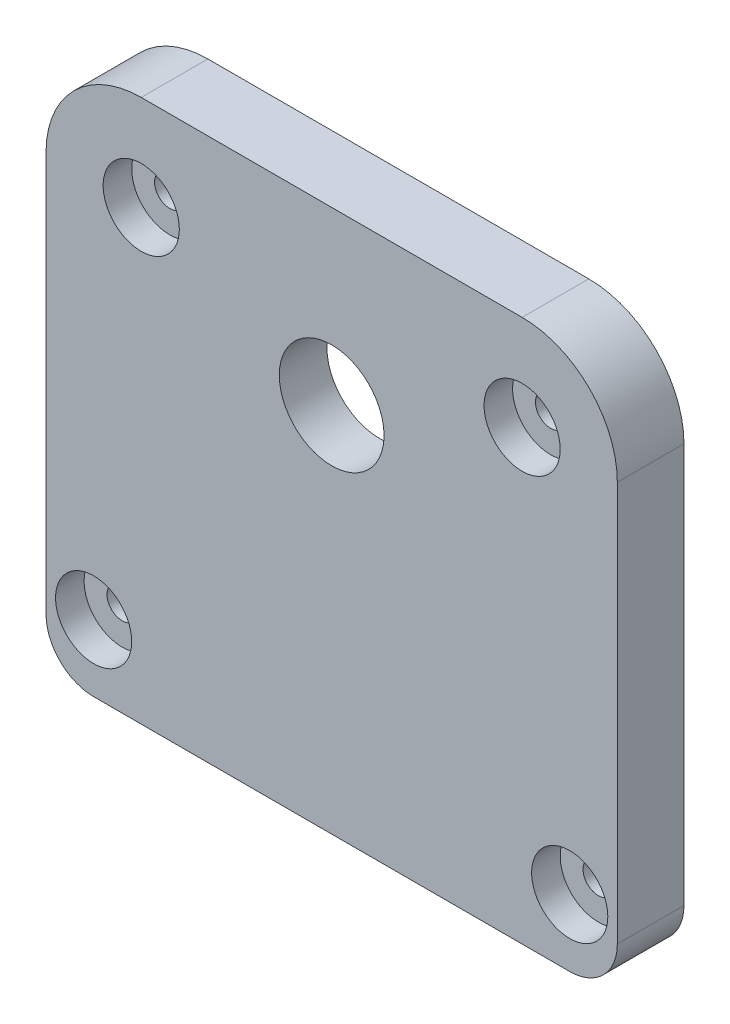
from build123d import *

# Parameters (mm, degrees)
SKETCH_1_W          = 60
SKETCH_1_H          = 50
SKETCH_1_R          = 15
EXTRUDE_5_DEPTH     = 5
SKETCH_4_W          = 60
SKETCH_4_H          = 50
SKETCH_4_R          = 5.5
EXTRUDE_6_DEPTH     = 5
SKETCH_5_R          = 1.6
CUT_EXTRUDE_1_DEPTH = 10
SKETCH_6_W          = 60
SKETCH_6_H          = 10
EXTRUDE_7_DEPTH     = 7
FILLET_3_R          = 10
FILLET_5_R          = 10
FILLET_6_R          = 5
FILLET_7_R          = 5
SKETCH_8_R          = 41.984876442
CUT_EXTRUDE_3_DEPTH = 3
SKETCH_7_R          = 4
CUT_EXTRUDE_4_DEPTH = 3
SKETCH_9_R          = 15
EXTRUDE_8_DEPTH     = 7
SKETCH_10_R         = 15
CUT_EXTRUDE_5_DEPTH = 2
SKETCH_11_R         = 5.5
CUT_EXTRUDE_6_DEPTH = 45.147480109


with BuildPart() as part:
    # 草图1 → 凸台-拉伸5 (new body)
    with BuildSketch(Plane.XY):
        Rectangle(SKETCH_1_W, SKETCH_1_H)
        Circle(SKETCH_1_R, mode=Mode.SUBTRACT)
    extrude(amount=EXTRUDE_5_DEPTH)

    # 草图4 → 凸台-拉伸6 (add)
    with BuildSketch(Plane.XY.offset(5)):
        Rectangle(SKETCH_4_W, SKETCH_4_H)
        Circle(SKETCH_4_R, mode=Mode.SUBTRACT)
    extrude(amount=EXTRUDE_6_DEPTH)

    # 草图5 → 切除-拉伸1 (cut)
    with BuildSketch(Plane(origin=(0, 0, 0), x_dir=(-1, 0, 0), z_dir=(0, 0, -1))):
        with Locations((-20, 22)):
            Circle(SKETCH_5_R)
        with Locations((-25, -18)):
            Circle(SKETCH_5_R)
        with Locations((20, 22)):
            Circle(SKETCH_5_R)
        with Locations((25, -18)):
            Circle(SKETCH_5_R)
    extrude(amount=-CUT_EXTRUDE_1_DEPTH, mode=Mode.SUBTRACT)

    # 草图6 → 凸台-拉伸7 (add)
    with BuildSketch(Plane(origin=(0, 25, 0), x_dir=(1, 0, 0), z_dir=(0, 1, 0))):
        with Locations((0, -5)):
            Rectangle(SKETCH_6_W, SKETCH_6_H)
    extrude(amount=EXTRUDE_7_DEPTH)

    # 圆角3
    fillet_3_edges = [part.edges().sort_by_distance(p)[0] for p in [
        (-30, 32, 5),
    ]]
    fillet(fillet_3_edges, radius=FILLET_3_R)

    # 圆角5
    fillet_5_edges = [part.edges().sort_by_distance(p)[0] for p in [
        (30, 32, 5),
    ]]
    fillet(fillet_5_edges, radius=FILLET_5_R)

    # 圆角6
    fillet_6_edges = [part.edges().sort_by_distance(p)[0] for p in [
        (-30, -25, 5),
    ]]
    fillet(fillet_6_edges, radius=FILLET_6_R)

    # 圆角7
    fillet_7_edges = [part.edges().sort_by_distance(p)[0] for p in [
        (30, -25, 5),
    ]]
    fillet(fillet_7_edges, radius=FILLET_7_R)

    # 草图8 → 切除-拉伸3 (cut)
    with BuildSketch(Plane(origin=(0, 0, 0), x_dir=(-1, 0, 0), z_dir=(0, 0, -1))):
        Circle(SKETCH_8_R)
    extrude(amount=-CUT_EXTRUDE_3_DEPTH, mode=Mode.SUBTRACT)

    # 草图7 → 切除-拉伸4 (cut)
    with BuildSketch(Plane.XY.offset(10)):
        with Locations((-20, 22)):
            Circle(SKETCH_7_R)
        with Locations((20, 22)):
            Circle(SKETCH_7_R)
        with Locations((-25, -18)):
            Circle(SKETCH_7_R)
        with Locations((25, -18)):
            Circle(SKETCH_7_R)
    extrude(amount=-CUT_EXTRUDE_4_DEPTH, mode=Mode.SUBTRACT)

    # 草图9 → 凸台-拉伸8 (add)
    with BuildSketch(Plane(origin=(0, 0, 3), x_dir=(-1, 0, 0), z_dir=(0, 0, -1))):
        Circle(SKETCH_9_R)
    extrude(amount=-EXTRUDE_8_DEPTH)

    # 草图10 → 切除-拉伸5 (cut)
    with BuildSketch(Plane(origin=(0, 0, 3), x_dir=(-1, 0, 0), z_dir=(0, 0, -1))):
        with Locations((0, 14)):
            Circle(SKETCH_10_R)
    extrude(amount=-CUT_EXTRUDE_5_DEPTH, mode=Mode.SUBTRACT)

    # 草图11 → 切除-拉伸6 (cut, through all)
    with BuildSketch(Plane(origin=(0, 0, 5), x_dir=(-1, 0, 0), z_dir=(0, 0, -1))):
        with Locations((0, 14)):
            Circle(SKETCH_11_R)
    extrude(amount=-CUT_EXTRUDE_6_DEPTH, mode=Mode.SUBTRACT)


solid = part.part
